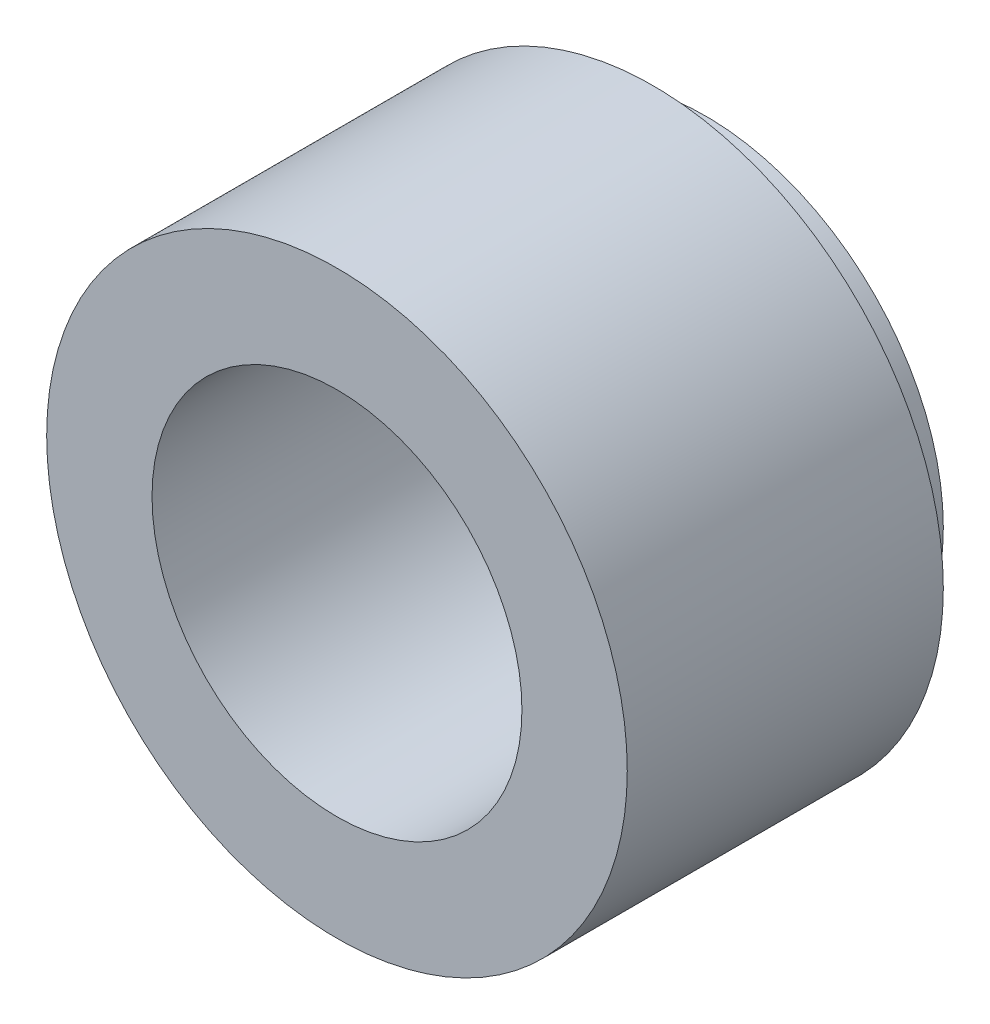
from build123d import *


with BuildPart() as part:
    # Sketch1 → Revolve1 (revolve)
    with BuildSketch(Plane(origin=(0, 0, 0), x_dir=(0, 0, -1), z_dir=(1, 0, 0)), mode=Mode.PRIVATE) as revolve1_sk:
        Polygon((-13.145457686, 10.116968004), (-13.145457686, 17.350888004), (8.556302314, 17.350888004), (8.556302314, 13.733928004), (12.173262314, 13.733928004), (12.173262314, 10.116968004), align=None)
    revolve(revolve1_sk.sketch.rotate(Axis((0, -2.583031996, 33.72322668), (0, 0, -1)), 90), axis=Axis((0, -2.583031996, 33.72322668), (0, 0, -1)))


solid = part.part
